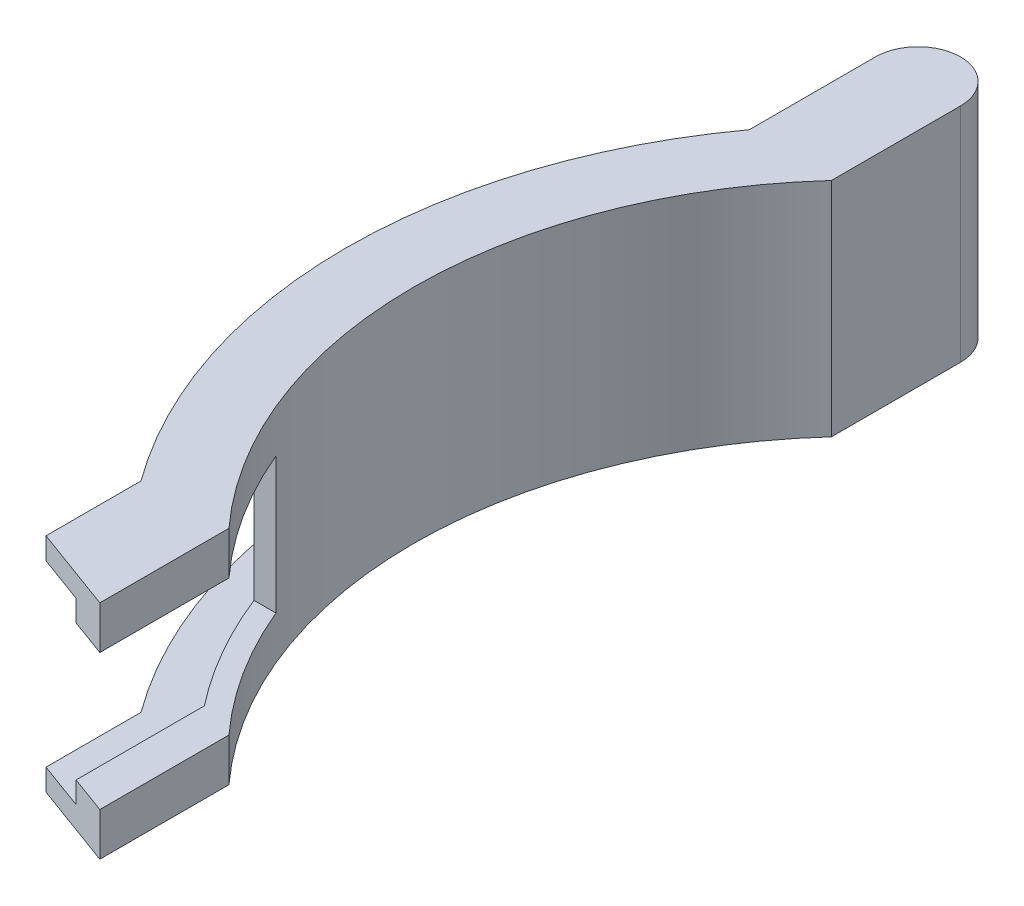
from build123d import *

# Parameters (mm, degrees)
BOSS_EXTRU_1_DEPTH = 1.575
BOSS_EXTRU_2_DEPTH = 1.6
BOSS_EXTRU_3_START = 10.033
BOSS_EXTRU_3_DEPTH = 10.033
BOSS_EXTRU_4_START = 1.575
BOSS_EXTRU_4_DEPTH = 1.575
BOSS_EXTRU_5_DEPTH = 9.308913653
BOSS_EXTRU_6_START = 1.6
BOSS_EXTRU_6_DEPTH = 1.6
BOSS_EXTRU_7_START = -16.383
ESQUISSE8_R        = 3.134999997
BOSS_EXTRU_7_DEPTH = 16.383


with BuildPart() as part:
    # Esquisse1 → Boss.-Extru.1 (new body)
    with BuildSketch(Plane.XZ.offset(-13.208)):
        with BuildLine():
            Line((20.6502, 3.175000004), (20.6502, 12.699999997))
            Line((20.6502, 12.699999997), (17.880200006, 11.68494557))
            Line((17.880200006, 11.68494557), (17.880200006, 2.217278617))
            ThreePointArc((17.880200006, 2.217278617), (10.55088334, -19.05), (17.880200006, -40.317278617))
            Line((17.880200006, -40.317278617), (17.880200006, -41.491086347))
            Line((17.880200006, -41.491086347), (20.6502, -41.491086347))
            Line((20.6502, -41.491086347), (20.6502, -41.275000004))
            ThreePointArc((20.6502, -41.275000004), (12.05088334, -19.05), (20.6502, 3.175000004))
        make_face()
    extrude(amount=-BOSS_EXTRU_1_DEPTH)

    # Esquisse2 → Boss.-Extru.2 (add)
    with BuildSketch(Plane(origin=(0, 14.783, 0), x_dir=(-1, 0, 0), z_dir=(0, 1, 0))):
        with BuildLine():
            Line((-14.380200006, -41.491086347), (-20.6502, -41.491086347))
            Line((-20.6502, -41.491086347), (-20.6502, -41.275000004))
            ThreePointArc((-20.6502, -41.275000004), (-12.05088334, -19.05), (-20.6502, 3.175000004))
            Line((-20.6502, 3.175000004), (-20.6502, 12.699999997))
            Line((-20.6502, 12.699999997), (-14.380200006, 10.402385822))
            Line((-14.380200006, 10.402385822), (-14.380200006, 3.391086347))
            ThreePointArc((-14.380200006, 3.391086347), (-7.05088334, -19.05), (-14.380200006, -41.491086347))
        make_face()
    extrude(amount=BOSS_EXTRU_2_DEPTH)

    # Esquisse3 → Boss.-Extru.3 (add)
    with BuildSketch(Plane.XZ.offset(-13.208).offset(BOSS_EXTRU_3_START)):
        with BuildLine():
            Line((12.971967471, -6.35), (14.59088334, -6.35))
            ThreePointArc((14.59088334, -6.35), (12.536898584, -24.69448721), (20.6502, -41.275000003))
            Line((20.6502, -41.275000003), (20.6502, -41.491086346))
            Line((20.6502, -41.491086346), (17.880200006, -41.491086346))
            Line((17.880200006, -41.491086346), (17.880200006, -40.317278616))
            ThreePointArc((17.880200006, -40.317278616), (10.90572349, -23.986826144), (12.971967471, -6.35))
        make_face()
    extrude(amount=-BOSS_EXTRU_3_DEPTH)

    # Esquisse4 → Boss.-Extru.4 (add)
    with BuildSketch(Plane.XZ.offset(-3.175).offset(BOSS_EXTRU_4_START)):
        with BuildLine():
            Line((17.880200006, -41.491086347), (17.880200006, -40.317278617))
            ThreePointArc((17.880200006, -40.317278617), (10.55088334, -19.05), (17.880200006, 2.217278617))
            Line((17.880200006, 2.217278617), (17.880200006, 11.68494557))
            Line((17.880200006, 11.68494557), (20.6502, 12.699999997))
            Line((20.6502, 12.699999997), (20.6502, 3.175000004))
            ThreePointArc((20.6502, 3.175000004), (12.05088334, -19.05), (20.6502, -41.275000004))
            Line((20.6502, -41.275000004), (20.6502, -41.491086347))
            Line((20.6502, -41.491086347), (17.880200006, -41.491086347))
        make_face()
    extrude(amount=-BOSS_EXTRU_4_DEPTH)

    # Esquisse5 → Boss.-Extru.5 (add)
    with BuildSketch(Plane(origin=(0, 0, -41.491086347), x_dir=(-1, 0, 0), z_dir=(0, 0, -1))):
        Polygon((-20.6502, 1.6), (-20.6502, 16.383), (-14.380200006, 16.383), (-14.380200006, 14.783), (-17.880200006, 14.783), (-17.880200006, 1.6), align=None)
    extrude(amount=BOSS_EXTRU_5_DEPTH)

    # Esquisse6 → Boss.-Extru.6 (add)
    with BuildSketch(Plane.XZ.offset(-1.6).offset(BOSS_EXTRU_6_START)):
        with BuildLine():
            Line((20.6502, -41.275000004), (20.6502, -50.8))
            Line((20.6502, -50.8), (14.380200006, -50.8))
            Line((14.380200006, -50.8), (14.380200006, -41.491086347))
            ThreePointArc((14.380200006, -41.491086347), (7.05088334, -19.05), (14.380200006, 3.391086347))
            Line((14.380200006, 3.391086347), (14.380200006, 10.402385822))
            Line((14.380200006, 10.402385822), (20.6502, 12.699999997))
            Line((20.6502, 12.699999997), (20.6502, 3.175000004))
            ThreePointArc((20.6502, 3.175000004), (12.05088334, -19.05), (20.6502, -41.275000004))
        make_face()
    extrude(amount=-BOSS_EXTRU_6_DEPTH)

    # Esquisse8 → Boss.-Extru.7 (add)
    with BuildSketch(Plane(origin=(0, 16.383, 0), x_dir=(1, 0, 0), z_dir=(0, 1, 0)).offset(BOSS_EXTRU_7_START)):
        with Locations((17.515200003, 50.8)):
            Circle(ESQUISSE8_R)
    extrude(amount=BOSS_EXTRU_7_DEPTH)


solid = part.part
